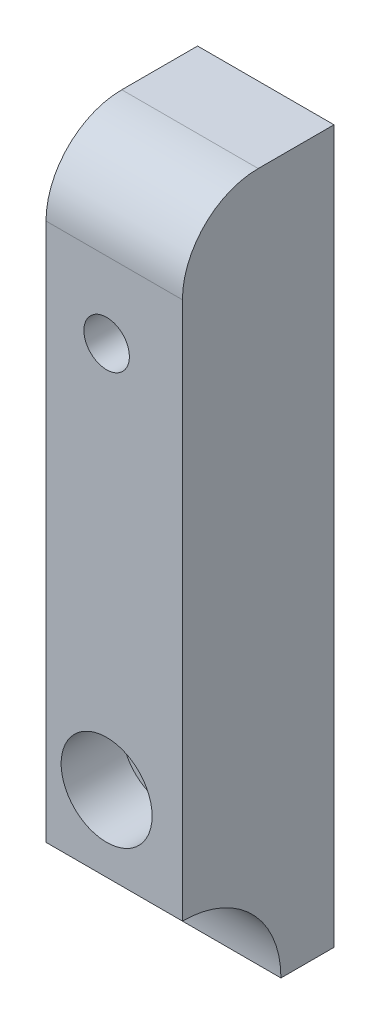
from build123d import *

# Parameters (mm, degrees)
SKETCH1_W           = 10
SKETCH1_H           = 47
BOSS_EXTRUDE1_DEPTH = 10
SKETCH2_R           = 1.5
CUT_EXTRUDE1_DEPTH  = 10
FILLET1_R           = 5
SKETCH3_W           = 10
SKETCH3_H           = 47
CUT_EXTRUDE2_DEPTH  = 1
SKETCH4_R           = 6.5
CUT_EXTRUDE3_DEPTH  = 22
SKETCH5_R           = 3
CUT_EXTRUDE4_DEPTH  = 4


with BuildPart() as part:
    # Sketch1 → Boss-Extrude1 (new body)
    with BuildSketch(Plane.XY):
        with Locations((5, 23.5)):
            Rectangle(SKETCH1_W, SKETCH1_H)
    extrude(amount=BOSS_EXTRUDE1_DEPTH)

    # Sketch2 → Cut-Extrude1 (cut)
    with BuildSketch(Plane.XY.offset(10)):
        with Locations((5, 37)):
            Circle(SKETCH2_R)
        with Locations((5, 11.5)):
            Circle(SKETCH2_R)
    extrude(amount=-CUT_EXTRUDE1_DEPTH, mode=Mode.SUBTRACT)

    # Fillet1
    fillet1_edges = [part.edges().sort_by_distance(p)[0] for p in [
        (5, 47, 10),
    ]]
    fillet(fillet1_edges, radius=FILLET1_R)

    # Sketch3 → Cut-Extrude2 (cut)
    with BuildSketch(Plane.ZY):
        with Locations((5, 23.5)):
            Rectangle(SKETCH3_W, SKETCH3_H)
    extrude(amount=-CUT_EXTRUDE2_DEPTH, mode=Mode.SUBTRACT)

    # Sketch4 → Cut-Extrude3 (cut)
    with BuildSketch(Plane.ZY.offset(-1)):
        with Locations((10, 0)):
            Circle(SKETCH4_R)
    extrude(amount=-CUT_EXTRUDE3_DEPTH, mode=Mode.SUBTRACT)

    # Sketch5 → Cut-Extrude4 (cut)
    with BuildSketch(Plane.XY.offset(10)):
        with Locations((5, 11.5)):
            Circle(SKETCH5_R)
    extrude(amount=-CUT_EXTRUDE4_DEPTH, mode=Mode.SUBTRACT)


solid = part.part
